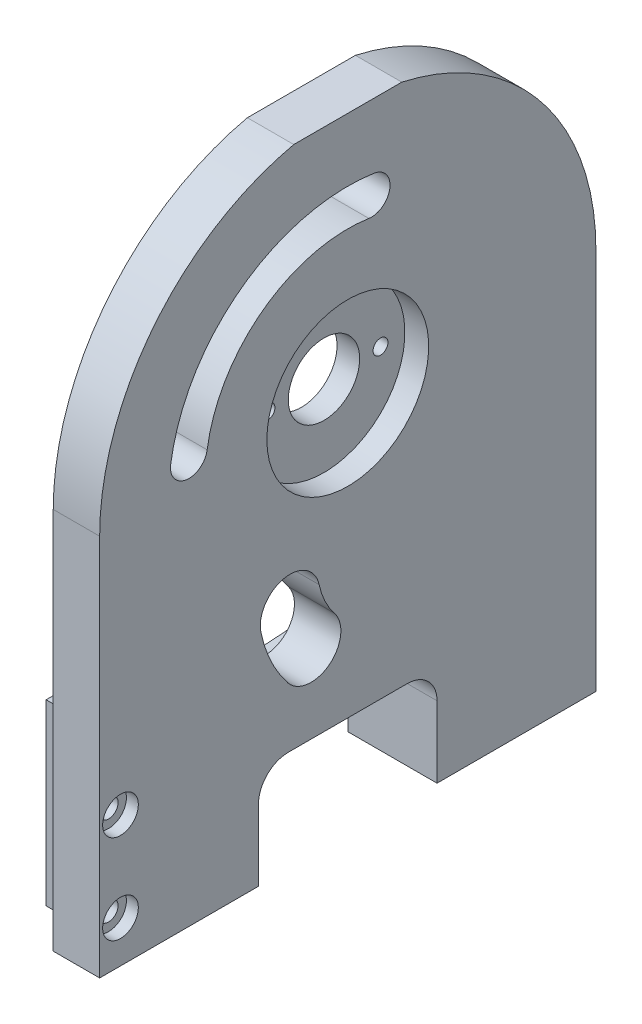
from build123d import *

# Parameters (mm, degrees)
SKETCH_1_W           = 7.8
SKETCH_1_H           = 83.4
EXTRUDE_1_DEPTH      = 105
CUT_EXTRUDE_1_DEPTH  = 135.318278726
SKETCH_3_R           = 6
CUT_EXTRUDE_2_DEPTH  = 135.318278726
SKETCH_4_R           = 13.6
CUT_EXTRUDE_3_DEPTH  = 4
SKETCH_5_R           = 1.25
CUT_EXTRUDE_4_DEPTH  = 4
EXTRUDE_2_DEPTH      = 7.2
SKETCH_7_W           = 6
SKETCH_7_H           = 30
CUT_EXTRUDE_5_DEPTH  = 7.2
CUT_EXTRUDE_6_DEPTH  = 135.92798079
SKETCH_9_R           = 1.65
CUT_EXTRUDE_7_DEPTH  = 15
FILLET_1_R           = 5
CUT_EXTRUDE_8_DEPTH  = 135.92798079
CUT_EXTRUDE_10_DEPTH = 135.92798079
SKETCH_14_R          = 1.6
CUT_EXTRUDE_11_DEPTH = 135.92798079
SKETCH_15_R          = 3
CUT_EXTRUDE_12_DEPTH = 2


with BuildPart() as part:
    # 草图1 → 凸台-拉伸1 (new body)
    with BuildSketch(Plane(origin=(0, 0, 0), x_dir=(1, 0, 0), z_dir=(0, 1, 0))):
        with Locations((3.9, -41.7)):
            Rectangle(SKETCH_1_W, SKETCH_1_H)
    extrude(amount=EXTRUDE_1_DEPTH)

    # 草图2 → 切除-拉伸1 (cut, through all)
    with BuildSketch(Plane.ZY):
        with BuildLine():
            Line((0, 64.3), (0, 105))
            Line((0, 105), (32.622555426, 105))
            ThreePointArc((32.622555426, 105), (9.162180169, 90.380266115), (0, 64.3))
        make_face()
        with BuildLine():
            Line((83.4, 105), (83.4, 64.3))
            ThreePointArc((83.4, 64.3), (74.237819831, 90.380266115), (50.777444574, 105))
            Line((50.777444574, 105), (83.4, 105))
        make_face()
    extrude(amount=-CUT_EXTRUDE_1_DEPTH, mode=Mode.SUBTRACT)

    # 草图3 → 切除-拉伸2 (cut, through all)
    with BuildSketch(Plane.ZY):
        with Locations((41.7, 64.3)):
            Circle(SKETCH_3_R)
    extrude(amount=-CUT_EXTRUDE_2_DEPTH, mode=Mode.SUBTRACT)

    # 草图4 → 切除-拉伸3 (cut)
    with BuildSketch(Plane.ZY):
        with Locations((41.7, 64.3)):
            Circle(SKETCH_4_R)
    extrude(amount=-CUT_EXTRUDE_3_DEPTH, mode=Mode.SUBTRACT)

    # 草图5 → 切除-拉伸4 (cut)
    with BuildSketch(Plane.ZY.offset(-4)):
        with Locations((32.2, 64.3)):
            Circle(SKETCH_5_R)
        with Locations((51.2, 64.3)):
            Circle(SKETCH_5_R)
    extrude(amount=-CUT_EXTRUDE_4_DEPTH, mode=Mode.SUBTRACT)

    # 草图6 → 凸台-拉伸2 (add)
    with BuildSketch(Plane(origin=(7.8, 0, 0), x_dir=(0, 0, -1), z_dir=(1, 0, 0))):
        with BuildLine():
            ThreePointArc((-14.146415841, 30), (-26.974511893, 22.286540784), (-41.7, 19.6))
            Line((-41.7, 19.6), (-41.7, 0))
            Line((-41.7, 0), (0, 0))
            Line((0, 0), (0, 30))
            Line((0, 30), (-14.146415841, 30))
        make_face()
        with BuildLine():
            Line((-41.7, 0), (-41.7, 19.6))
            ThreePointArc((-41.7, 19.6), (-56.425488107, 22.286540784), (-69.253584159, 30))
            Line((-69.253584159, 30), (-83.4, 30))
            Line((-83.4, 30), (-83.4, 0))
            Line((-83.4, 0), (-41.7, 0))
        make_face()
    extrude(amount=EXTRUDE_2_DEPTH)

    # 草图7 → 切除-拉伸5 (cut)
    with BuildSketch(Plane(origin=(15, 0, 0), x_dir=(0, 0, -1), z_dir=(1, 0, 0))):
        with Locations((-80.4, 15)):
            Rectangle(SKETCH_7_W, SKETCH_7_H)
    extrude(amount=-CUT_EXTRUDE_5_DEPTH, mode=Mode.SUBTRACT)

    # 草图8 → 切除-拉伸6 (cut, through all)
    with BuildSketch(Plane.ZY):
        with BuildLine():
            Line((31.7, 17), (51.7, 17))
            ThreePointArc((51.7, 17), (55.235533906, 15.535533906), (56.7, 12))
            Line((56.7, 12), (56.7, 0))
            Line((56.7, 0), (26.7, 0))
            Line((26.7, 0), (26.7, 12))
            ThreePointArc((26.7, 12), (28.164466094, 15.535533906), (31.7, 17))
        make_face()
    extrude(amount=-CUT_EXTRUDE_6_DEPTH, mode=Mode.SUBTRACT)

    # 草图9 → 切除-拉伸7 (cut)
    with BuildSketch(Plane.XZ):
        with Locations(Location((7.5, 73.4, 0), (0, 0, 270))):
            Circle(SKETCH_9_R)
        with Locations(Location((7.5, 62.7, 0), (0, 0, 270))):
            Circle(SKETCH_9_R)
        with Locations(Location((7.5, 20.7, 0), (0, 0, 270))):
            Circle(SKETCH_9_R)
        with Locations(Location((7.5, 6, 0), (0, 0, 270))):
            Circle(SKETCH_9_R)
    extrude(amount=-CUT_EXTRUDE_7_DEPTH, mode=Mode.SUBTRACT)


with BuildPart() as body_2:
    # 镜向2: mirrored copy
    add(part.part.mirror(Plane(origin=(0, 0, 0), x_dir=(0, 0, 1), z_dir=(1, 0, 0))))

    # 圆角1
    fillet_1_edges = [body_2.edges().sort_by_distance(p)[0] for p in [
        (-11.4, 30, 14.146415841),
        (-11.4, 30, 69.253584159),
    ]]
    fillet(fillet_1_edges, radius=FILLET_1_R)

    # 草图10 → 切除-拉伸8 (cut, through all)
    with BuildSketch(Plane(origin=(0, 0, 0), x_dir=(0, 0, -1), z_dir=(1, 0, 0))):
        with BuildLine():
            ThreePointArc((-37.240706086, 94.065786869), (-59.594392776, 88.500786708), (-71.465786869, 68.759293914))
            ThreePointArc((-71.465786869, 68.759293914), (-68.859293916, 65.234213137), (-65.334213139, 67.840706089))
            ThreePointArc((-65.334213139, 67.840706089), (-55.908255092, 83.515569664), (-38.159293911, 87.934213139))
            ThreePointArc((-38.159293911, 87.934213139), (-34.634213133, 90.540706091), (-37.240706086, 94.065786869))
        make_face()
    extrude(amount=-CUT_EXTRUDE_8_DEPTH, mode=Mode.SUBTRACT)

    # 草图13 → 切除-拉伸10 (cut, through all)
    with BuildSketch(Plane(origin=(0, 0, 0), x_dir=(0, 0, -1), z_dir=(1, 0, 0))):
        with BuildLine():
            ThreePointArc((-56.294598294, 36.728714307), (-54.592965975, 31.672402134), (-51.772187936, 27.144151191))
            ThreePointArc((-51.772187936, 27.144151191), (-44.745463477, 26.353491098), (-43.954803385, 33.380215557))
            ThreePointArc((-43.954803385, 33.380215557), (-45.549156189, 35.939661742), (-46.51094837, 38.797577319))
            ThreePointArc((-46.51094837, 38.797577319), (-52.437204837, 42.654970775), (-56.294598294, 36.728714307))
        make_face()
    extrude(amount=-CUT_EXTRUDE_10_DEPTH, mode=Mode.SUBTRACT)

    # 草图14 → 切除-拉伸11 (cut, through all)
    with BuildSketch(Plane(origin=(0, 0, 0), x_dir=(0, 0, -1), z_dir=(1, 0, 0))):
        with Locations((-79.9, 7)):
            Circle(SKETCH_14_R)
        with Locations((-79.9, 22)):
            Circle(SKETCH_14_R)
    extrude(amount=-CUT_EXTRUDE_11_DEPTH, mode=Mode.SUBTRACT)

    # 草图15 → 切除-拉伸12 (cut)
    with BuildSketch(Plane(origin=(0, 0, 0), x_dir=(0, 0, -1), z_dir=(1, 0, 0))):
        with Locations((-79.9, 22)):
            Circle(SKETCH_15_R)
        with Locations((-79.9, 7)):
            Circle(SKETCH_15_R)
    extrude(amount=-CUT_EXTRUDE_12_DEPTH, mode=Mode.SUBTRACT)


solid = body_2.part
